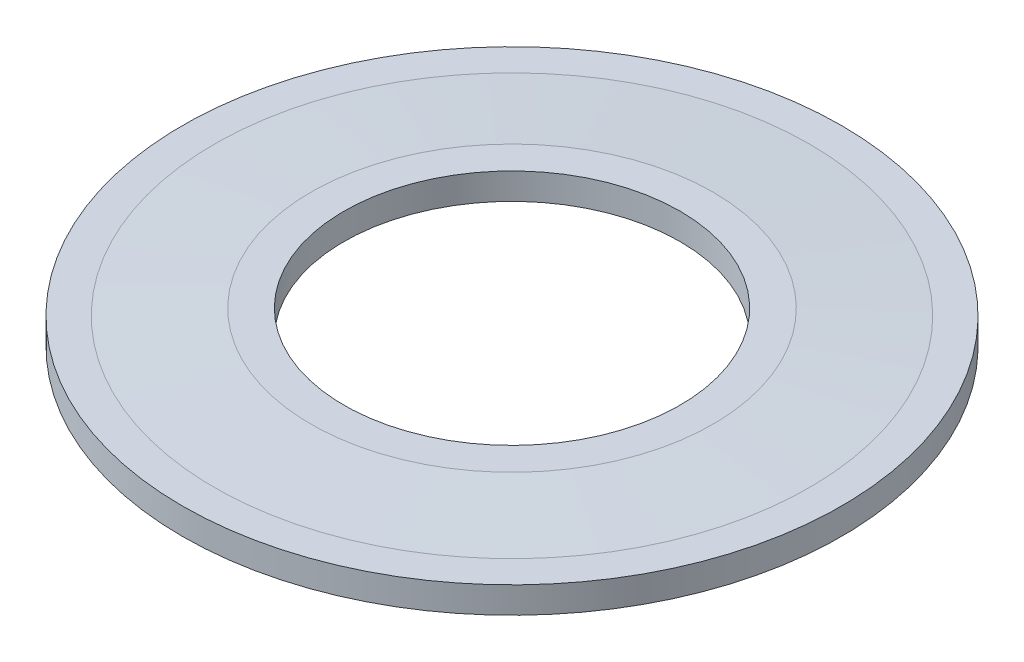
from build123d import *


with BuildPart() as part:
    # Schizzo1 → Rivoluzione1 (revolve)
    with BuildSketch(Plane.XY, mode=Mode.PRIVATE) as rivoluzione1_sk:
        Polygon((-10, 0), (-9, 0), (-6.072702854, 0.2), (-5.1, 0.2), (-5.1, 1), (-6.1, 1), (-9.027297146, 0.8), (-10, 0.8), align=None)
    revolve(rivoluzione1_sk.sketch.rotate(Axis((0, 0, 0), (0, 1, 0)), 270), axis=Axis((0, 0, 0), (0, 1, 0)))


solid = part.part
